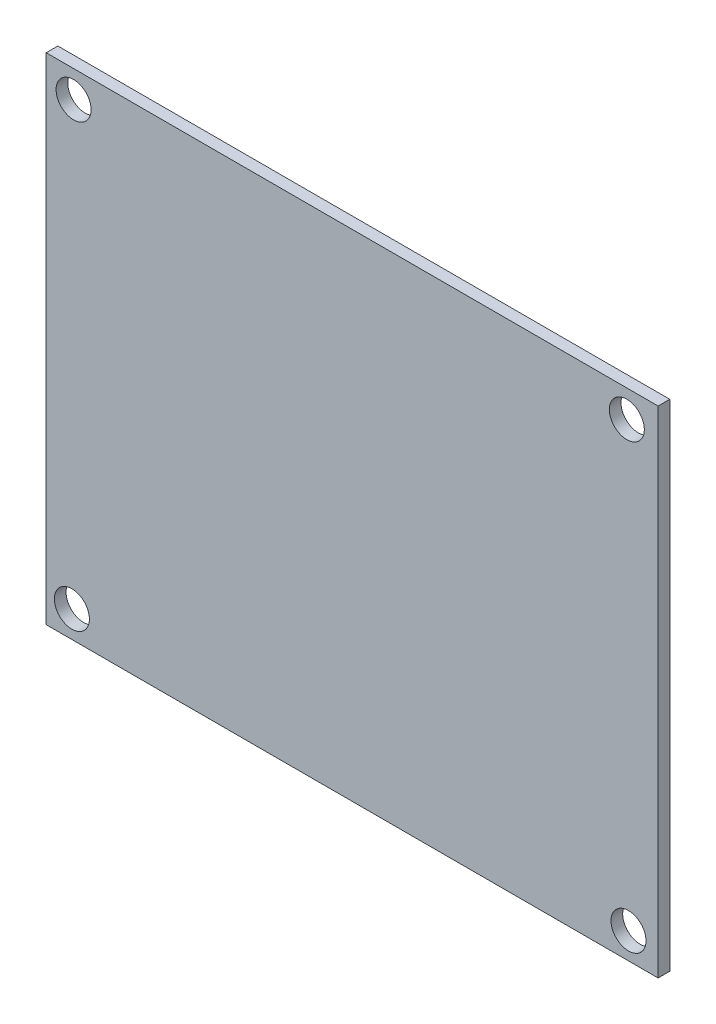
from build123d import *

# Parameters (mm, degrees)
SKETCH2_W           = 105
SKETCH2_H           = 85
SKETCH2_R           = 3.003381929
BOSS_EXTRUDE1_DEPTH = 2


with BuildPart() as part:
    # Sketch2 → Boss-Extrude1 (new body)
    with BuildSketch(Plane.XY):
        with Locations((4.276504298, -8.889684814)):
            Rectangle(SKETCH2_W, SKETCH2_H)
        with Locations((-43.5259303, 28.985078975)):
            Circle(SKETCH2_R, mode=Mode.SUBTRACT)
        with Locations((51.407290981, 28.92964073)):
            Circle(SKETCH2_R, mode=Mode.SUBTRACT)
        with Locations((51.69590649, -46.914500559)):
            Circle(SKETCH2_R, mode=Mode.SUBTRACT)
        with Locations((-43.819903107, -46.849492866)):
            Circle(SKETCH2_R, mode=Mode.SUBTRACT)
    extrude(amount=BOSS_EXTRUDE1_DEPTH)


solid = part.part
